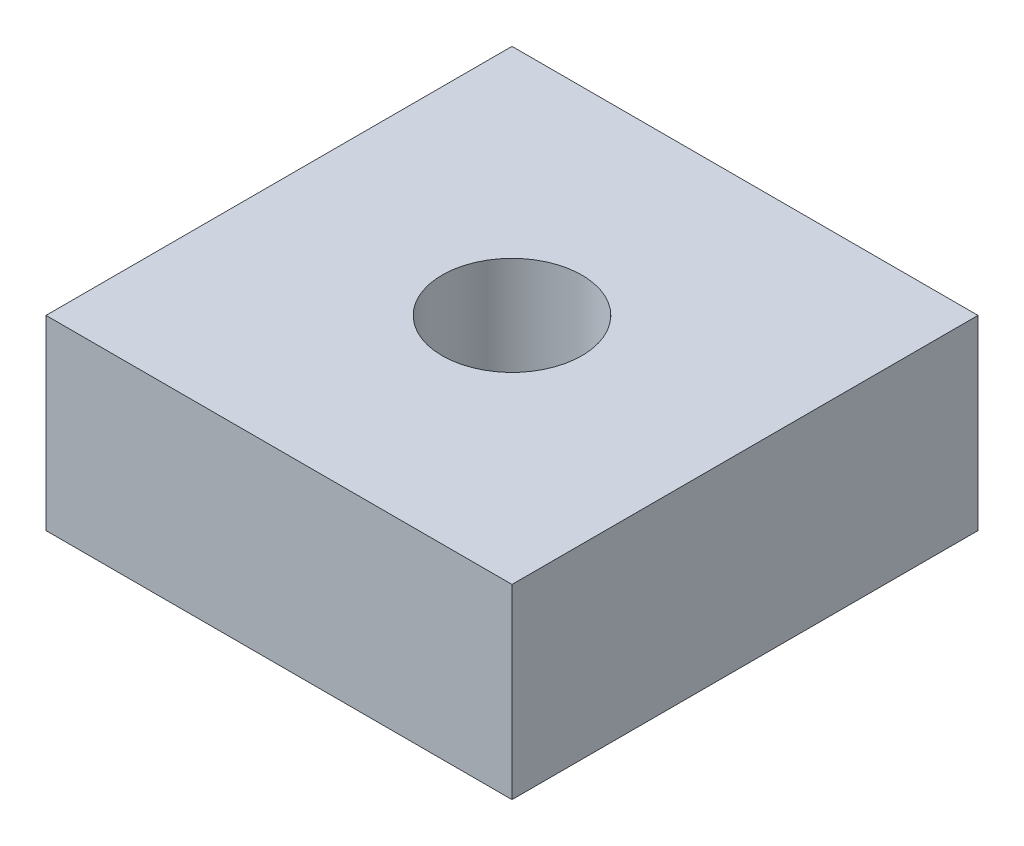
from build123d import *

# Parameters (mm, degrees)
SKETCH1_W           = 50
SKETCH1_H           = 50
SKETCH1_R           = 7.5
BOSS_EXTRUDE1_DEPTH = 10


with BuildPart() as part:
    # Sketch1 → Boss-Extrude1 (new, symmetric)
    with BuildSketch(Plane(origin=(0, 0, 0), x_dir=(1, 0, 0), z_dir=(0, 1, 0))):
        Rectangle(SKETCH1_W, SKETCH1_H)
        with Locations(Location((0, 0, 0), (0, 0, 270))):
            Circle(SKETCH1_R, mode=Mode.SUBTRACT)
    extrude(amount=BOSS_EXTRUDE1_DEPTH, both=True)


solid = part.part
